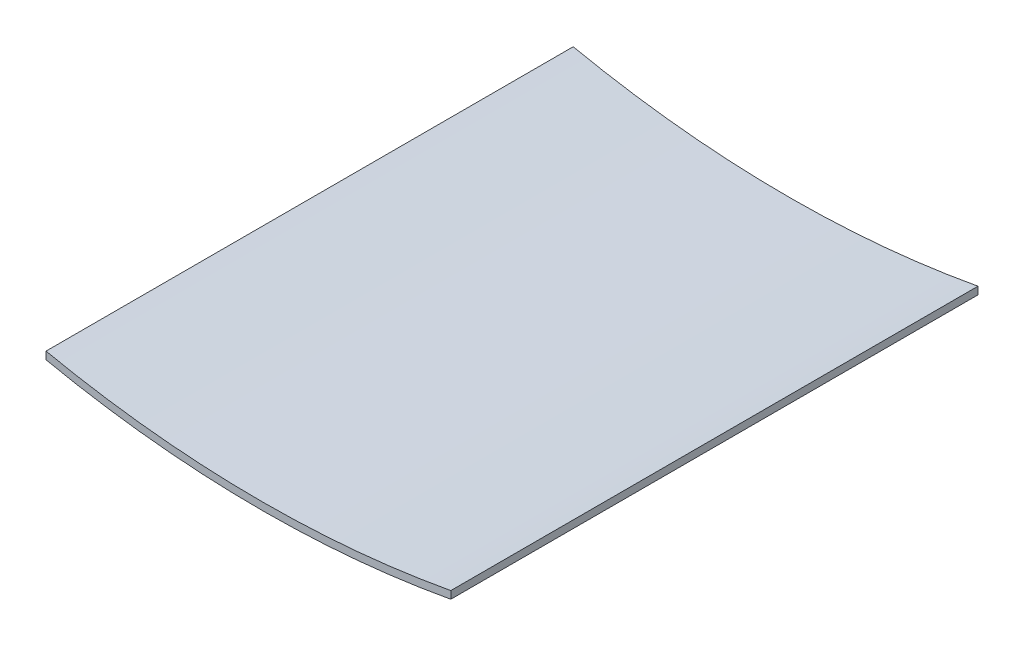
from build123d import *

# Parameters (mm, degrees)
BOSS_EXTRUDE1_DEPTH = 266.7
CUT_EXTRUDE1_DEPTH  = 304.8


with BuildPart() as part:
    # Sketch1 → Boss-Extrude1 (new body)
    with BuildSketch(Plane.XY):
        with BuildLine():
            Line((204.7875, -2.511386267), (204.7875, -7.591386267))
            ThreePointArc((204.7875, -7.591386267), (102.270785822, -16.362635969), (0, -5.08))
            Line((0, -5.08), (0, 0))
            ThreePointArc((0, 0), (102.270785822, -11.282635969), (204.7875, -2.511386267))
        make_face()
    extrude(amount=BOSS_EXTRUDE1_DEPTH)

    # Sketch2 → Cut-Extrude1 (cut)
    with BuildSketch(Plane(origin=(0, 0, 0), x_dir=(-1, 0, 0), z_dir=(0, 0, -1))):
        with BuildLine():
            ThreePointArc((0, 0), (-102.270785822, -11.282635969), (-204.7875, -2.511386267))
            Line((-204.7875, -2.511386267), (-204.7875, -3.781386267))
            ThreePointArc((-204.7875, -3.781386267), (-102.270785822, -12.552635969), (0, -1.27))
            Line((0, -1.27), (0, 0))
        make_face()
    extrude(amount=-CUT_EXTRUDE1_DEPTH, mode=Mode.SUBTRACT)


solid = part.part
